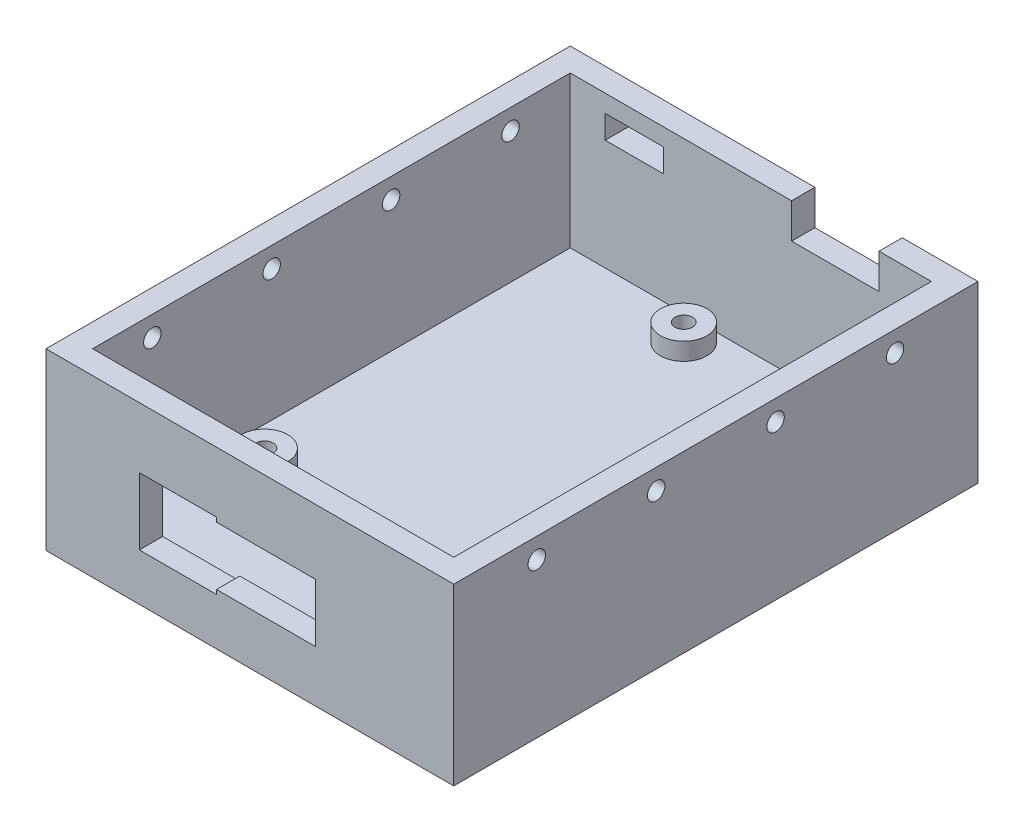
from build123d import *

# Parameters (mm, degrees)
SKETCH1_W               = 70
SKETCH1_H               = 90
BOSS_EXTRUDE1_DEPTH     = 30
SHELL1_T                = -4
SKETCH2_W               = 13.25
SKETCH2_H               = 11.5
SKETCH2_W_2             = 11.25
SKETCH2_H_2             = 9.5
CUT_EXTRUDE1_DEPTH      = 7
SKETCH3_W               = 18
SKETCH3_H               = 10
CUT_EXTRUDE2_DEPTH      = 7
SKETCH4_W               = 15
SKETCH4_H               = 6
CUT_EXTRUDE3_DEPTH      = 7
SKETCH6_R               = 4
SKETCH6_R_2             = 1.5
BOSS_EXTRUDE2_DEPTH     = 7
CUT_EXTRUDE4_DEPTH      = 86.32877592
CUT_EXTRUDE4_DEPTH_BACK = 86.32877592
SKETCH7_R               = 1.5
SKETCH8_W               = 10
SKETCH8_H               = 4
CUT_EXTRUDE5_DEPTH      = 7


with BuildPart() as part:
    # Sketch1 → Boss-Extrude1 (new body)
    with BuildSketch(Plane(origin=(0, 0, 0), x_dir=(1, 0, 0), z_dir=(0, 1, 0))):
        Rectangle(SKETCH1_W, SKETCH1_H)
    extrude(amount=BOSS_EXTRUDE1_DEPTH)

    # Shell1
    shell1_openings = [part.faces().sort_by_distance(p)[0] for p in [
        (0, 30, 0),
    ]]
    offset(amount=SHELL1_T, openings=shell1_openings, kind=Kind.INTERSECTION)

    # Sketch2 → Cut-Extrude1 (cut)
    # profile 1 of 2: a face of its own
    with BuildSketch(Plane.XY.offset(45)):
        with Locations((-12.349103725, 13.85)):
            Rectangle(SKETCH2_W, SKETCH2_H)
        with Locations((-12.349103725, 13.85)):
            Rectangle(SKETCH2_W_2, SKETCH2_H_2, mode=Mode.SUBTRACT)
    # profile 2 of 2: a face of its own
    with BuildSketch(Plane.XY.offset(45)):
        with Locations((-12.349103725, 13.85)):
            Rectangle(SKETCH2_W_2, SKETCH2_H_2)
    extrude(amount=-CUT_EXTRUDE1_DEPTH, mode=Mode.SUBTRACT)

    # Sketch3 → Cut-Extrude2 (cut)
    with BuildSketch(Plane.XY.offset(45)):
        with Locations((2.275896275, 13.85)):
            Rectangle(SKETCH3_W, SKETCH3_H)
    extrude(amount=-CUT_EXTRUDE2_DEPTH, mode=Mode.SUBTRACT)

    # Sketch4 → Cut-Extrude3 (cut)
    with BuildSketch(Plane(origin=(0, 0, -45), x_dir=(-1, 0, 0), z_dir=(0, 0, -1))):
        with Locations((-14.5, 27)):
            Rectangle(SKETCH4_W, SKETCH4_H)
    extrude(amount=-CUT_EXTRUDE3_DEPTH, mode=Mode.SUBTRACT)

    # Sketch6 → Boss-Extrude2 (add)
    # profile 1 of 4: a face of its own
    with BuildSketch(Plane(origin=(0, 0, -1.719487256), x_dir=(1, 0, 0), z_dir=(0, -1, 0))):
        with Locations(Location((-24.474103725, 19.735790835, 0), (0, 0, 270))):
            Circle(SKETCH6_R)
        with Locations(Location((-24.474103725, 19.735790835, 0), (0, 0, 270))):
            Circle(SKETCH6_R_2, mode=Mode.SUBTRACT)
    # profile 2 of 4: a face of its own
    with BuildSketch(Plane(origin=(0, 0, -1.719487256), x_dir=(1, 0, 0), z_dir=(0, -1, 0))):
        with Locations(Location((25.025896275, 19.735790835, 0), (0, 0, 270))):
            Circle(SKETCH6_R)
        with Locations(Location((25.025896275, 19.735790835, 0), (0, 0, 270))):
            Circle(SKETCH6_R_2, mode=Mode.SUBTRACT)
    # profile 3 of 4: a face of its own
    with BuildSketch(Plane(origin=(0, 0, -1.719487256), x_dir=(1, 0, 0), z_dir=(0, -1, 0))):
        with Locations(Location((20.309236753, -34.964209165, 0), (0, 0, 270))):
            Circle(SKETCH6_R)
        with Locations(Location((20.309236753, -34.964209165, 0), (0, 0, 270))):
            Circle(SKETCH6_R_2, mode=Mode.SUBTRACT)
    # profile 4 of 4: a face of its own
    with BuildSketch(Plane(origin=(0, 0, -1.719487256), x_dir=(1, 0, 0), z_dir=(0, -1, 0))):
        with Locations(Location((-7.207089355, -34.964209165, 0), (0, 0, 270))):
            Circle(SKETCH6_R)
        with Locations(Location((-7.207089355, -34.964209165, 0), (0, 0, 270))):
            Circle(SKETCH6_R_2, mode=Mode.SUBTRACT)
    extrude(amount=-BOSS_EXTRUDE2_DEPTH)

    # Sketch7 → Cut-Extrude4 (cut, two sides: drawn at the far end of the back side and taken through both)
    with BuildSketch(Plane.ZY.offset(-31).offset(-CUT_EXTRUDE4_DEPTH_BACK)):
        with Locations((-30.75, 26.5)):
            Circle(SKETCH7_R)
        with Locations((-10.25, 26.5)):
            Circle(SKETCH7_R)
        with Locations((10.25, 26.5)):
            Circle(SKETCH7_R)
        with Locations((30.75, 26.5)):
            Circle(SKETCH7_R)
    extrude(amount=CUT_EXTRUDE4_DEPTH + CUT_EXTRUDE4_DEPTH_BACK, mode=Mode.SUBTRACT)

    # Sketch8 → Cut-Extrude5 (cut)
    with BuildSketch(Plane(origin=(0, 0, -45), x_dir=(-1, 0, 0), z_dir=(0, 0, -1))):
        with Locations((20, 25)):
            Rectangle(SKETCH8_W, SKETCH8_H)
    extrude(amount=-CUT_EXTRUDE5_DEPTH, mode=Mode.SUBTRACT)


solid = part.part
